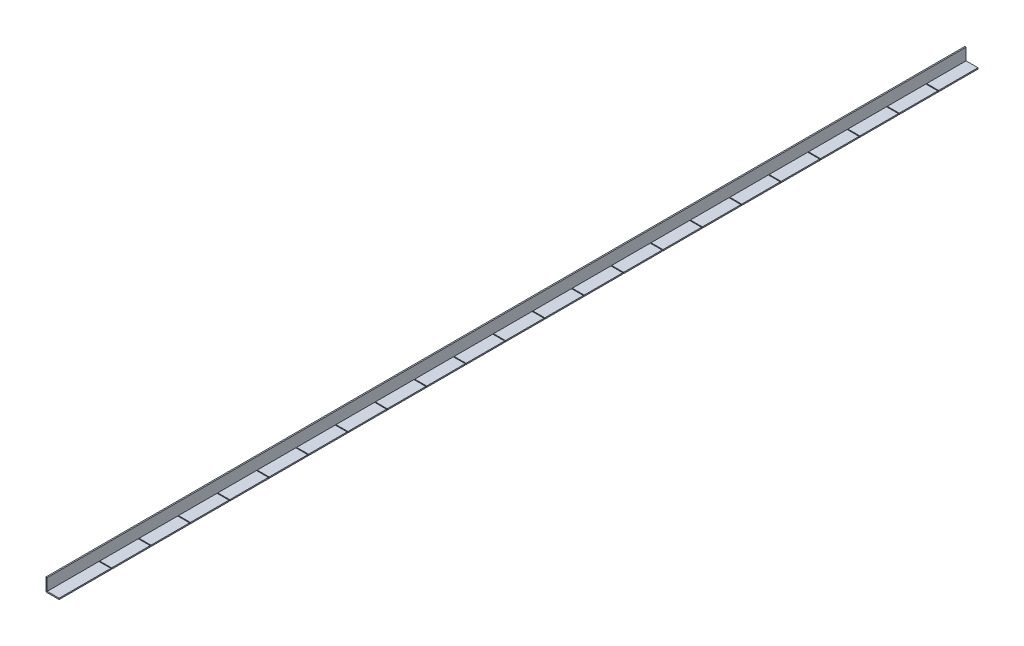
from build123d import *

# Parameters (mm, degrees)
BOSS_EXTRUDE1_DEPTH = 3556
SKETCH2_W           = 3.175
SKETCH2_H           = 10.040349426
CUT_EXTRUDE1_DEPTH  = 80
LPATTERN1_COUNT     = 22
LPATTERN1_PITCH     = 152.4


with BuildPart() as part:
    # Sketch1 → Boss-Extrude1 (new body)
    with BuildSketch(Plane.XY):
        Polygon((0, 0), (50.8, 0), (50.8, 4.7625), (4.7625, 4.7625), (4.7625, 50.8), (0, 50.8), align=None)
    extrude(amount=BOSS_EXTRUDE1_DEPTH)

    # Sketch2 → Cut-Extrude1 (cut)
    with BuildSketch(Plane(origin=(4.7625, 0, 0), x_dir=(0, 0, -1), z_dir=(1, 0, 0))):
        with Locations((-153.9875, -0.257674713)):
            Rectangle(SKETCH2_W, SKETCH2_H)
    cut_extrude1 = extrude(amount=CUT_EXTRUDE1_DEPTH, mode=Mode.SUBTRACT)

    # LPattern1: Cut-Extrude1 ×22
    with Locations(*[(0, 0, i * LPATTERN1_PITCH) for i in range(1, LPATTERN1_COUNT)]):
        add(cut_extrude1, mode=Mode.SUBTRACT)


solid = part.part
